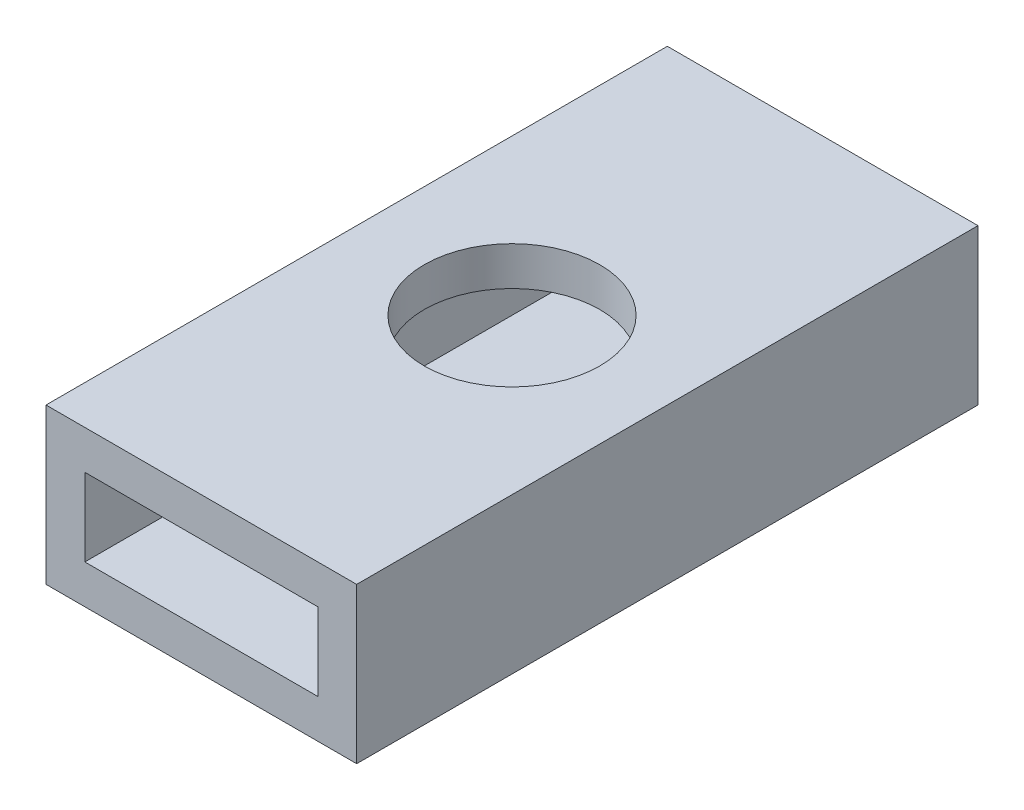
from build123d import *

# Parameters (mm, degrees)
SKETCH1_W           = 50.8
SKETCH1_H           = 25.4
BOSS_EXTRUDE1_DEPTH = 101.6
SKETCH2_W           = 38.1
SKETCH2_H           = 12.7
CUT_EXTRUDE1_DEPTH  = 117.397422652
CUT_EXTRUDE3_REACH  = 118.397
SKETCH5_R           = 14.351


with BuildPart() as part:
    # Sketch1 → Boss-Extrude1 (new body)
    with BuildSketch(Plane.XY):
        with Locations((25.4, 12.7)):
            Rectangle(SKETCH1_W, SKETCH1_H)
    extrude(amount=BOSS_EXTRUDE1_DEPTH)

    # Sketch2 → Cut-Extrude1 (cut, through all)
    with BuildSketch(Plane.XY.offset(101.6)):
        with Locations((25.4, 12.7)):
            Rectangle(SKETCH2_W, SKETCH2_H)
    extrude(amount=-CUT_EXTRUDE1_DEPTH, mode=Mode.SUBTRACT)

    # Sketch5 → Cut-Extrude3 (cut, up to next)
    with BuildSketch(Plane(origin=(0, 25.4, 0), x_dir=(1, 0, 0), z_dir=(0, 1, 0)), mode=Mode.PRIVATE) as cut_extrude3_sk1:
        with Locations(Location((25.4, -50.8, 0), (0, 0, 270))):
            Circle(SKETCH5_R)
    cut_extrude3_tool1 = extrude(cut_extrude3_sk1.sketch, amount=-CUT_EXTRUDE3_REACH, mode=Mode.PRIVATE) & part.part
    add(cut_extrude3_tool1.solids().sort_by_distance((25.4, 25.4, 50.8))[0], mode=Mode.SUBTRACT)


solid = part.part
